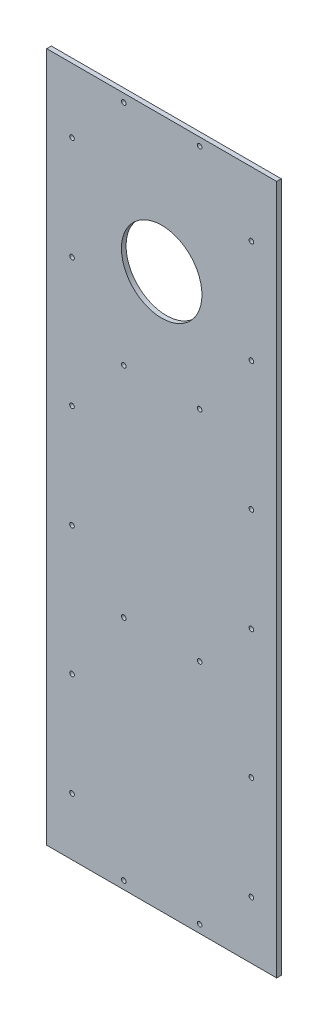
from build123d import *

# Parameters (mm, degrees)
SKETCH1_W           = 100
SKETCH1_H           = 300
BOSS_EXTRUDE1_DEPTH = 2
SKETCH2_R           = 1
CUT_EXTRUDE1_DEPTH  = 10
SKETCH3_R           = 17.5
CUT_EXTRUDE2_DEPTH  = 10
SKETCH5_R           = 1
CUT_EXTRUDE3_DEPTH  = 10


with BuildPart() as part:
    # Sketch1 → Boss-Extrude1 (new body)
    with BuildSketch(Plane.XY):
        Rectangle(SKETCH1_W, SKETCH1_H)
    extrude(amount=BOSS_EXTRUDE1_DEPTH)

    # Sketch2 → Cut-Extrude1 (cut)
    with BuildSketch(Plane.XY.offset(2)):
        with Locations((-39, 122)):
            Circle(SKETCH2_R)
        with Locations((-39, 77)):
            Circle(SKETCH2_R)
        with Locations((39, 122)):
            Circle(SKETCH2_R)
        with Locations((39, 77)):
            Circle(SKETCH2_R)
        with Locations((-39, 21)):
            Circle(SKETCH2_R)
        with Locations((-39, -24)):
            Circle(SKETCH2_R)
        with Locations((39, 21)):
            Circle(SKETCH2_R)
        with Locations((39, -24)):
            Circle(SKETCH2_R)
        with Locations((-39, -80)):
            Circle(SKETCH2_R)
        with Locations((-39, -125)):
            Circle(SKETCH2_R)
        with Locations((39, -80)):
            Circle(SKETCH2_R)
        with Locations((39, -125)):
            Circle(SKETCH2_R)
        with Locations((16.5, -146.5)):
            Circle(SKETCH2_R)
        with Locations((-16.5, -146.5)):
            Circle(SKETCH2_R)
        with Locations((-16.5, 146.5)):
            Circle(SKETCH2_R)
        with Locations((16.5, 146.5)):
            Circle(SKETCH2_R)
    extrude(amount=-CUT_EXTRUDE1_DEPTH, mode=Mode.SUBTRACT)

    # Sketch3 → Cut-Extrude2 (cut)
    with BuildSketch(Plane(origin=(0, 0, 0), x_dir=(-1, 0, 0), z_dir=(0, 0, -1))):
        with Locations((0, 91)):
            Circle(SKETCH3_R)
    extrude(amount=-CUT_EXTRUDE2_DEPTH, mode=Mode.SUBTRACT)

    # Sketch5 → Cut-Extrude3 (cut)
    with BuildSketch(Plane.XY.offset(2)):
        with Locations((-16.5, 47.5)):
            Circle(SKETCH5_R)
        with Locations((16.5, 47.5)):
            Circle(SKETCH5_R)
        with Locations((-16.5, -47.5)):
            Circle(SKETCH5_R)
        with Locations((16.5, -47.5)):
            Circle(SKETCH5_R)
    extrude(amount=-CUT_EXTRUDE3_DEPTH, mode=Mode.SUBTRACT)


solid = part.part
